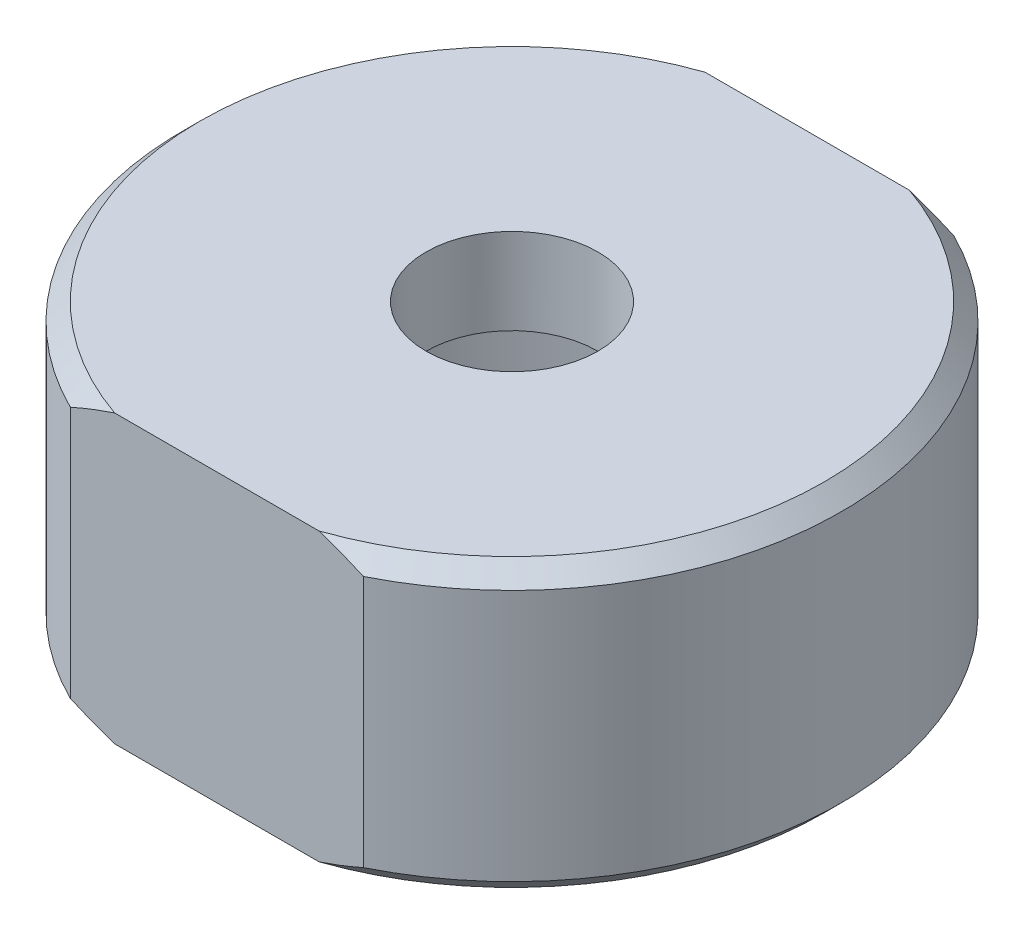
from build123d import *

# Parameters (mm, degrees)
SKETCH_1_R          = 1.5
EXTRUDE_1_DEPTH     = 5
SKETCH_2_R          = 4.9
CUT_EXTRUDE_1_DEPTH = 3.5
CHAMFER_1_SIZE      = 0.3


with BuildPart() as part:
    # ｽｹｯﾁ1 → ﾎﾞｽ - 押し出し1 (new body)
    with BuildSketch(Plane(origin=(0, 0, 0), x_dir=(1, 0, 0), z_dir=(0, 1, 0))):
        with BuildLine():
            Line((-2.557342371, -5.15), (2.557342371, -5.15))
            ThreePointArc((2.557342371, -5.15), (5.75, 0), (2.557342371, 5.15))
            Line((2.557342371, 5.15), (-2.557342371, 5.15))
            ThreePointArc((-2.557342371, 5.15), (-5.75, 0), (-2.557342371, -5.15))
        make_face()
        with Locations(Location((0, 0, 0), (0, 0, 270))):
            Circle(SKETCH_1_R, mode=Mode.SUBTRACT)
    extrude(amount=EXTRUDE_1_DEPTH)

    # ｽｹｯﾁ2 → ｶｯﾄ - 押し出し1 (cut)
    with BuildSketch(Plane.XZ):
        with Locations(Location((0, 0, 0), (0, 0, 270))):
            Circle(SKETCH_2_R)
    extrude(amount=-CUT_EXTRUDE_1_DEPTH, mode=Mode.SUBTRACT)

    # 面取り1
    chamfer_1_edges = [part.edges().sort_by_distance(p)[0] for p in [
        (5.75, 5, 0),
        (-5.75, 5, 0),
        (5.75, 0, 0),
        (-5.75, 0, 0),
    ]]
    chamfer(chamfer_1_edges, length=CHAMFER_1_SIZE)


solid = part.part
